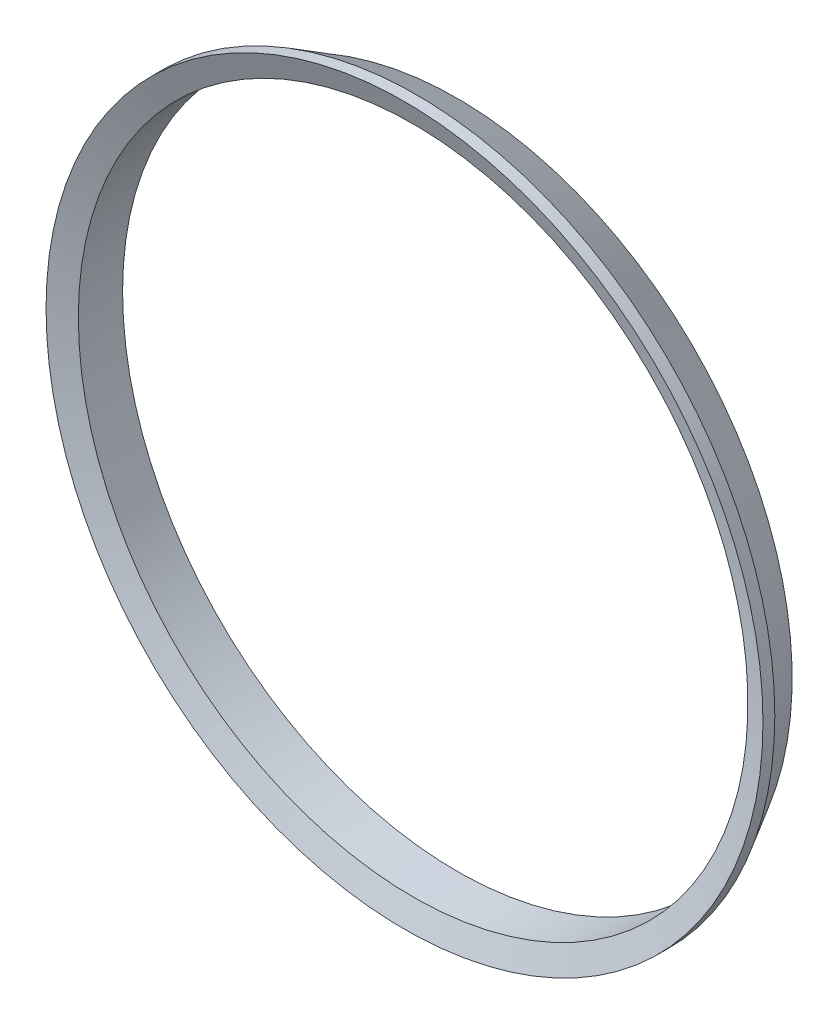
from build123d import *


with BuildPart() as part:
    # Sketch1 → Revolve1 (revolve)
    with BuildSketch(Plane.YZ, mode=Mode.PRIVATE) as revolve1_sk:
        Polygon((-141.4, 1.360297657), (-151.4, 5), (-151.4, 0), (-141.4, -17.320508076), align=None)
    revolve(revolve1_sk.sketch.rotate(Axis((0, 0, 0), (0, 0, 1)), 270), axis=Axis((0, 0, 0), (0, 0, 1)))


solid = part.part
